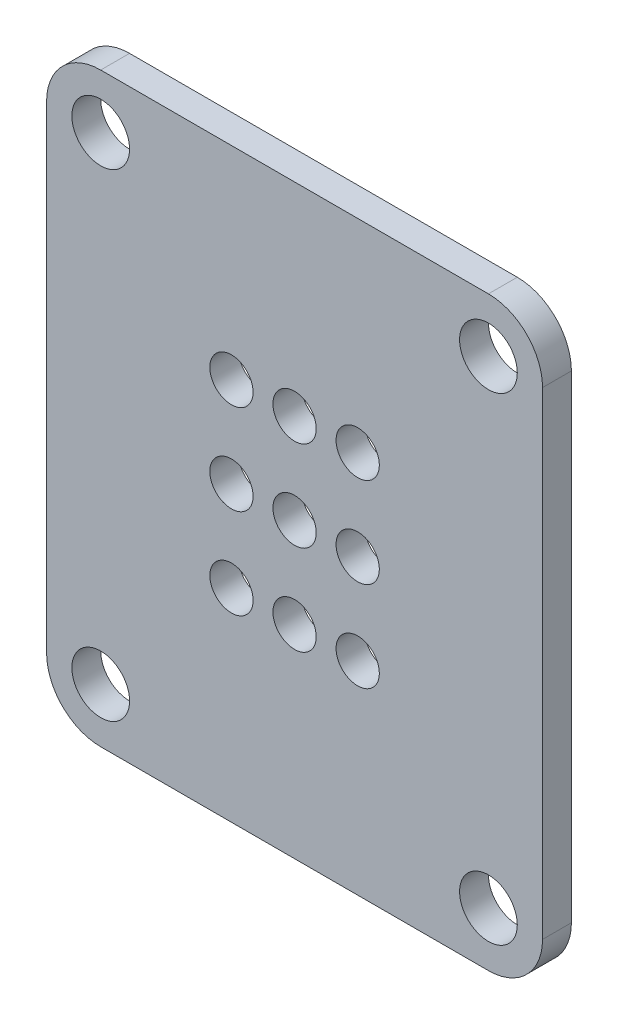
from build123d import *

# Parameters (mm, degrees)
BOSS_EXTRUDE1_DEPTH = 0.8
SKETCH4_R           = 1.6
CUT_EXTRUDE3_DEPTH  = 22.346779617
SKETCH5_R           = 1.2
CUT_EXTRUDE4_DEPTH  = 22.346779617


with BuildPart() as part:
    # Sketch1 → Boss-Extrude1 (new, symmetric)
    with BuildSketch(Plane.XY):
        with BuildLine():
            Line((-13.75, 13.25), (-13.75, -13.25))
            ThreePointArc((-13.75, -13.25), (-12.871320344, -15.371320344), (-10.75, -16.25))
            Line((-10.75, -16.25), (10.75, -16.25))
            ThreePointArc((10.75, -16.25), (12.871320344, -15.371320344), (13.75, -13.25))
            Line((13.75, -13.25), (13.75, 13.25))
            ThreePointArc((13.75, 13.25), (12.871320344, 15.371320344), (10.75, 16.25))
            Line((10.75, 16.25), (-10.75, 16.25))
            ThreePointArc((-10.75, 16.25), (-12.871320344, 15.371320344), (-13.75, 13.25))
        make_face()
    extrude(amount=BOSS_EXTRUDE1_DEPTH, both=True)

    # Sketch4 → Cut-Extrude3 (cut, through all)
    with BuildSketch(Plane.XY.offset(0.8)):
        with Locations((10.75, 13.25)):
            Circle(SKETCH4_R)
        with Locations((10.75, -13.25)):
            Circle(SKETCH4_R)
        with Locations((-10.75, -13.25)):
            Circle(SKETCH4_R)
        with Locations((-10.75, 13.25)):
            Circle(SKETCH4_R)
    extrude(amount=-CUT_EXTRUDE3_DEPTH, mode=Mode.SUBTRACT)

    # Sketch5 → Cut-Extrude4 (cut, through all)
    with BuildSketch(Plane.XY.offset(0.8)):
        with Locations((3.5, -5)):
            Circle(SKETCH5_R)
        with Locations((0, -5)):
            Circle(SKETCH5_R)
        with Locations((-3.5, -5)):
            Circle(SKETCH5_R)
        with Locations((3.5, 5)):
            Circle(SKETCH5_R)
        with Locations((0, 5)):
            Circle(SKETCH5_R)
        with Locations((-3.5, 5)):
            Circle(SKETCH5_R)
        with Locations((-3.5, 0)):
            Circle(SKETCH5_R)
        Circle(SKETCH5_R)
        with Locations((3.5, 0)):
            Circle(SKETCH5_R)
    extrude(amount=-CUT_EXTRUDE4_DEPTH, mode=Mode.SUBTRACT)


solid = part.part
